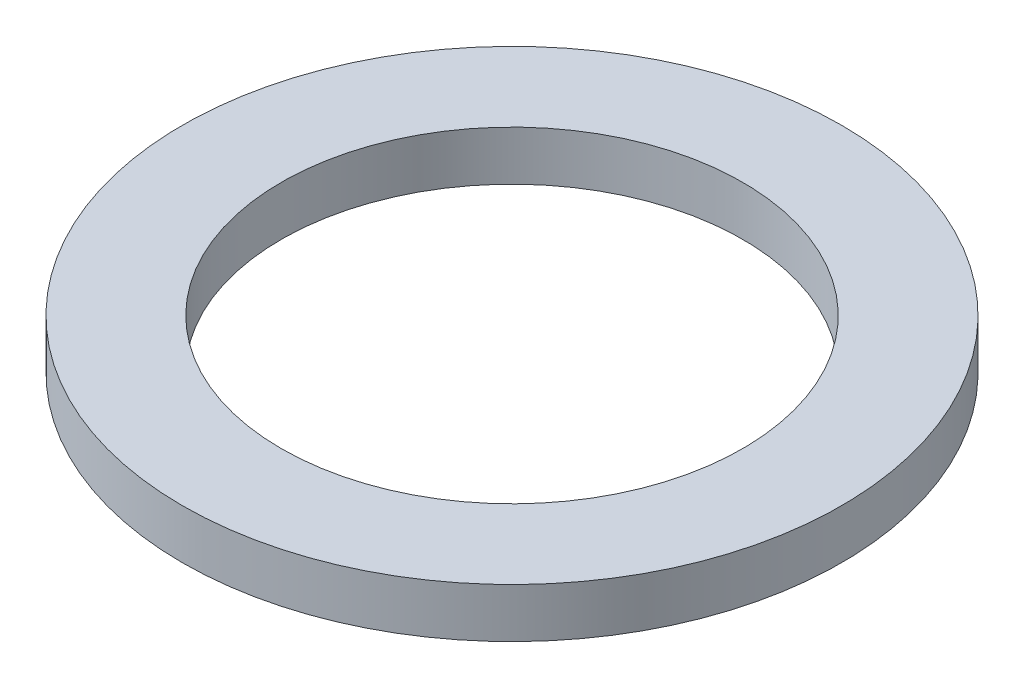
from build123d import *

# Parameters (mm, degrees)
SKETCH1_W = 3
SKETCH1_H = 1.5


with BuildPart() as part:
    # Sketch1 → Base-Revolve (revolve)
    with BuildSketch(Plane.XY, mode=Mode.PRIVATE) as base_revolve_sk:
        with Locations((8.5, 0.75)):
            Rectangle(SKETCH1_W, SKETCH1_H)
    revolve(base_revolve_sk.sketch.rotate(Axis((0, 10.216088328, 0), (0, -1, 0)), 90), axis=Axis((0, 10.216088328, 0), (0, -1, 0)))


solid = part.part
